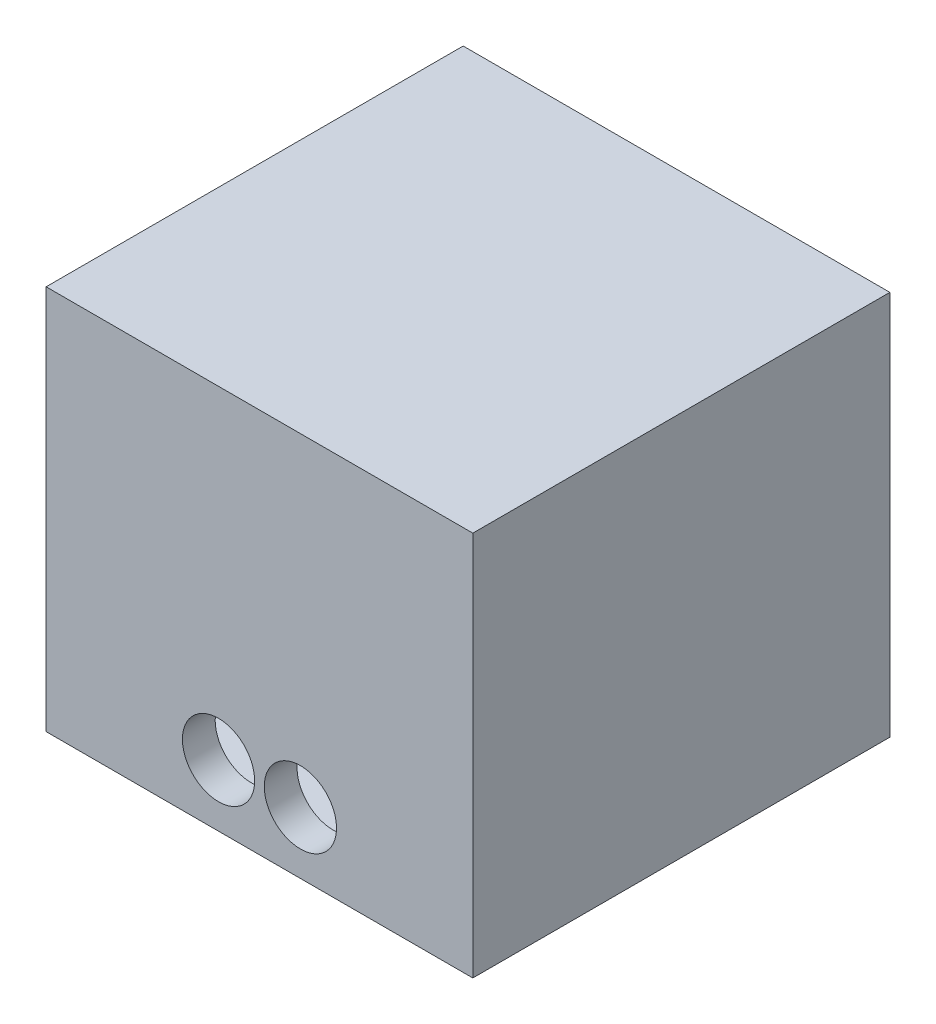
from build123d import *

# Parameters (mm, degrees)
SKETCH1_W           = 886
SKETCH1_H           = 800
BOSS_EXTRUDE1_DEPTH = 866
SKETCH2_W           = 750
SKETCH2_H           = 830
CUT_EXTRUDE1_DEPTH  = 850
CUT_EXTRUDE2_DEPTH  = 288
BOSS_EXTRUDE2_DEPTH = 50
HOLE1_D             = 150
HOLE1_DEPTH         = 68


with BuildPart() as part:
    # Sketch1 → Boss-Extrude1 (new body)
    with BuildSketch(Plane.XY.offset(433)):
        with Locations((0, 382)):
            Rectangle(SKETCH1_W, SKETCH1_H)
    extrude(amount=-BOSS_EXTRUDE1_DEPTH)

    # Sketch2 → Cut-Extrude1 (cut)
    with BuildSketch(Plane(origin=(-425, 0, 0), x_dir=(0, -1, 0), z_dir=(-1, 0, 0))):
        with Locations((-382, 0)):
            Rectangle(SKETCH2_W, SKETCH2_H)
    extrude(amount=-CUT_EXTRUDE1_DEPTH, mode=Mode.SUBTRACT)

    # Sketch3 → Cut-Extrude2 (cut)
    with BuildSketch(Plane(origin=(0, 0, -433), x_dir=(-1, 0, 0), z_dir=(0, 0, -1))):
        with BuildLine():
            Line((-300, 725), (-300, 715))
            ThreePointArc((-300, 715), (-295.606601718, 704.393398282), (-285, 700))
            Line((-285, 700), (285, 700))
            ThreePointArc((285, 700), (295.606601718, 704.393398282), (300, 715))
            Line((300, 715), (300, 725))
            ThreePointArc((300, 725), (295.606601718, 735.606601718), (285, 740))
            Line((285, 740), (-285, 740))
            ThreePointArc((-285, 740), (-295.606601718, 735.606601718), (-300, 725))
        make_face()
    extrude(amount=-CUT_EXTRUDE2_DEPTH, mode=Mode.SUBTRACT)

    # Sketch4 → Boss-Extrude2 (add)
    with BuildSketch(Plane(origin=(0, 0, 415), x_dir=(-1, 0, 0), z_dir=(0, 0, -1))):
        with BuildLine():
            ThreePointArc((0, 80.419601085), (-175, 110), (0, 139.580398915))
            ThreePointArc((0, 139.580398915), (175, 110), (0, 80.419601085))
        make_face()
    extrude(amount=BOSS_EXTRUDE2_DEPTH)

    # Hole1
    with Locations(Plane(origin=(0, 0, 365), x_dir=(-1, 0, 0), z_dir=(0, 0, -1))):
        with Locations((-85, 110), (85, 110)):
            Hole(HOLE1_D / 2, depth=HOLE1_DEPTH)


solid = part.part
